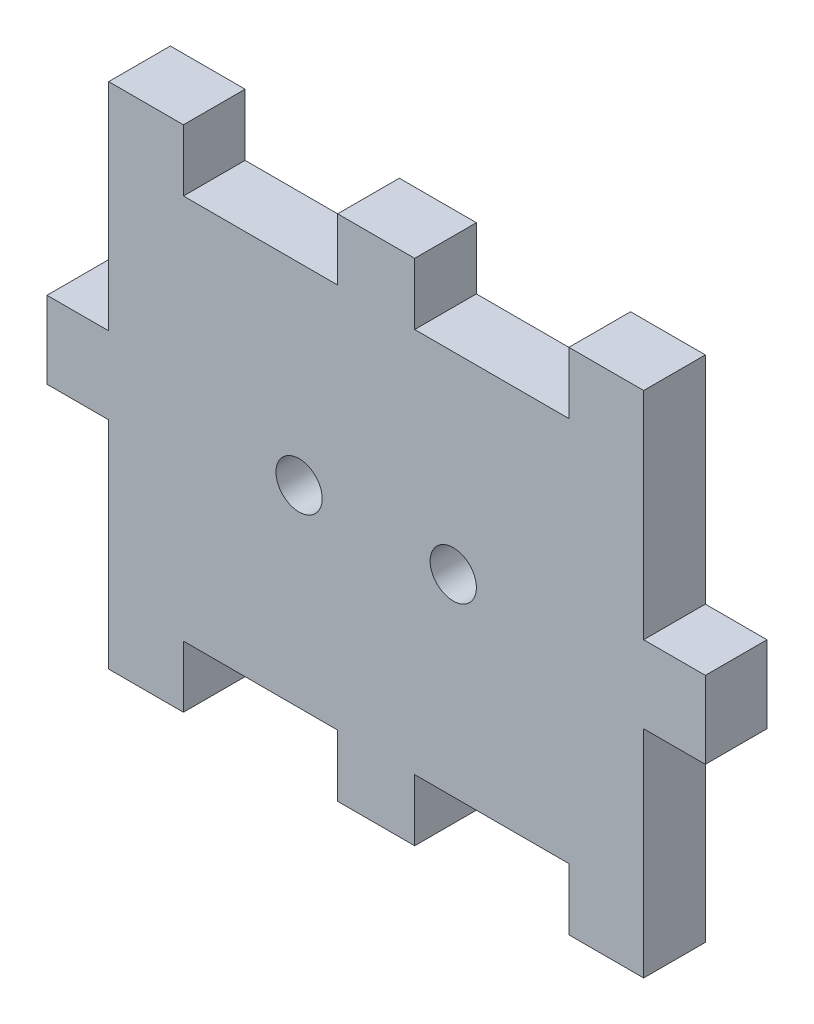
from build123d import *

# Parameters (mm, degrees)
SKETCH_1_W          = 42.7
SKETCH_1_H          = 33
EXTRUDE_1_DEPTH     = 4
SKETCH_2_R          = 1.5
SKETCH_2_W          = 10
SKETCH_2_H          = 4
SKETCH_2_W_2        = 4
SKETCH_2_H_2        = 14
CUT_EXTRUDE_2_DEPTH = 4


with BuildPart() as part:
    # Эскиз1 → Бобышка-Вытянуть1 (new body)
    with BuildSketch(Plane.XY):
        with Locations((17.35, 12.5)):
            Rectangle(SKETCH_1_W, SKETCH_1_H)
    extrude(amount=EXTRUDE_1_DEPTH)

    # Эскиз2 → Вырез-Вытянуть2 (cut)
    with BuildSketch(Plane.XY.offset(4)):
        with Locations((12.35, 12.5)):
            Circle(SKETCH_2_R)
        with Locations(Location((22.35, 12.5, 0), (0, 0, 180))):
            Circle(SKETCH_2_R)
        with Locations((9.85, 27)):
            Rectangle(SKETCH_2_W, SKETCH_2_H)
        with Locations((24.85, 27)):
            Rectangle(SKETCH_2_W, SKETCH_2_H)
        with Locations((-2, 3)):
            Rectangle(SKETCH_2_W_2, SKETCH_2_H_2)
        with Locations((-2, 22)):
            Rectangle(SKETCH_2_W_2, SKETCH_2_H_2)
        with Locations((24.85, -2)):
            Rectangle(SKETCH_2_W, SKETCH_2_H)
        with Locations((9.85, -2)):
            Rectangle(SKETCH_2_W, SKETCH_2_H)
        with Locations((36.7, 3)):
            Rectangle(SKETCH_2_W_2, SKETCH_2_H_2)
        with Locations((36.7, 22)):
            Rectangle(SKETCH_2_W_2, SKETCH_2_H_2)
    extrude(amount=-CUT_EXTRUDE_2_DEPTH, mode=Mode.SUBTRACT)


solid = part.part
